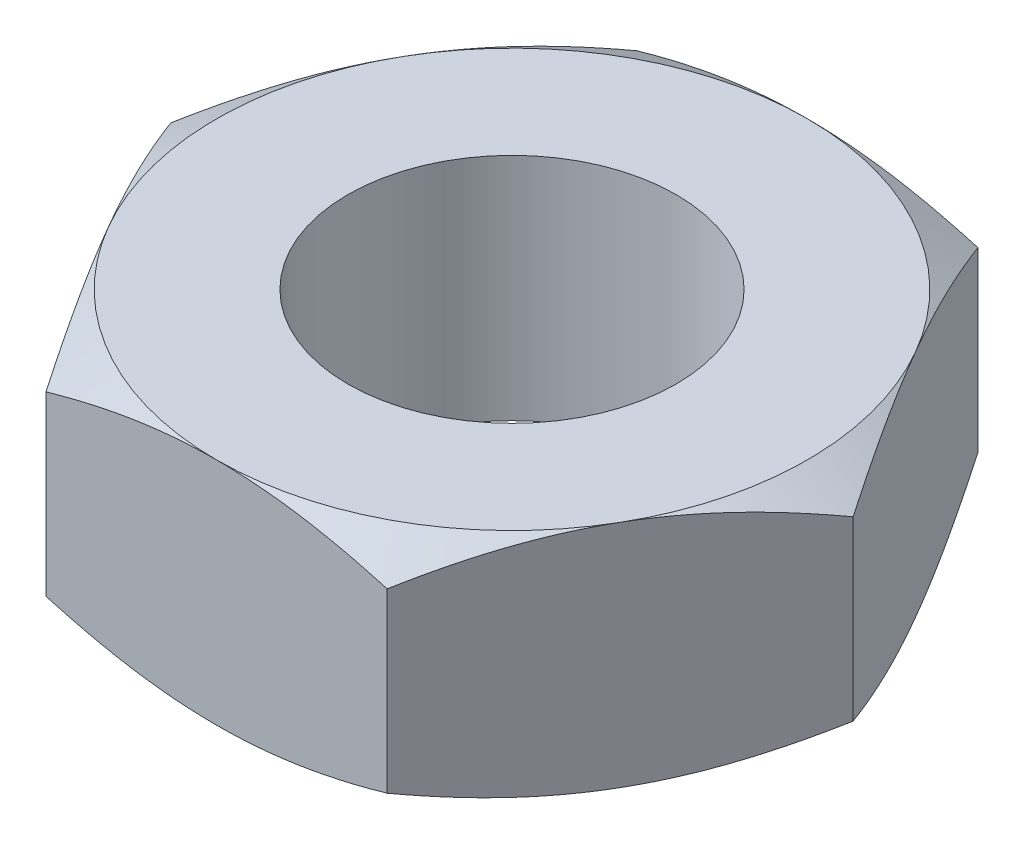
from build123d import *

# Parameters (mm, degrees)
SKETCH3_R               = 12.5
BOSS_EXTRUDE1_DEPTH     = 8.75
SKETCH4_OUTSIDE_W       = 75.076
SKETCH4_OUTSIDE_H       = 68.114
SKETCH4_OUTSIDE_R       = 22.5
CUT_EXTRUDE1_DEPTH      = 2
CUT_EXTRUDE1_DRAFT      = -60
MIRROR1_COPY_1_SKETCH_W = 75.076
MIRROR1_COPY_1_SKETCH_H = 68.114
MIRROR1_COPY_1_SKETCH_R = 22.5
MIRROR1_COPY_1_DEPTH    = 2
MIRROR1_COPY_1_DRAFT    = -60


with BuildPart() as part:
    # Sketch3 → Boss-Extrude1 (new, symmetric)
    with BuildSketch(Plane(origin=(0, 0, 0), x_dir=(1, 0, 0), z_dir=(0, 1, 0))):
        Polygon((25.980762114, 0), (12.990381057, 22.5), (-12.990381057, 22.5), (-25.980762114, 0), (-12.990381057, -22.5), (12.990381057, -22.5), align=None)
        with Locations(Location((0, 0, 0), (0, 0, 270))):
            Circle(SKETCH3_R, mode=Mode.SUBTRACT)
    extrude(amount=BOSS_EXTRUDE1_DEPTH, both=True)


with BuildPart() as cut_extrude1_tool:
    # Sketch4 outside → Cut-Extrude1 (with draft: the straight prism first)
    with BuildSketch(Plane.XZ.offset(8.75)):
        Rectangle(SKETCH4_OUTSIDE_W, SKETCH4_OUTSIDE_H)
        Circle(SKETCH4_OUTSIDE_R, mode=Mode.SUBTRACT)
    extrude(amount=-CUT_EXTRUDE1_DEPTH)
    # Cut-Extrude1: the draft: its side faces are tilted about the plane it starts from
    cut_extrude1_sides = [cut_extrude1_tool.faces().sort_by_distance(p)[0] for p in [
        (0, -7.75, -34.057),
        (37.538, -7.75, 0),
        (0, -7.75, 34.057),
        (-37.538, -7.75, 0),
        (-22.5, -7.75, 0),
    ]]
    draft(cut_extrude1_sides, Plane.XZ.offset(8.75), CUT_EXTRUDE1_DRAFT)


with BuildPart() as part_1:
    add(part.part)

    # Cut-Extrude1: cut by cut_extrude1_tool
    add(cut_extrude1_tool.part, mode=Mode.SUBTRACT)


with BuildPart() as mirror1_copy_1_tool:
    # Mirror1 copy 1 sketch → Mirror1 copy 1 (with draft: the straight prism first)
    with BuildSketch(Plane(origin=(0, 8.75, 0), x_dir=(1, 0, 0), z_dir=(0, 1, 0))):
        Rectangle(MIRROR1_COPY_1_SKETCH_W, MIRROR1_COPY_1_SKETCH_H)
        Circle(MIRROR1_COPY_1_SKETCH_R, mode=Mode.SUBTRACT)
    extrude(amount=-MIRROR1_COPY_1_DEPTH)
    # Mirror1 copy 1: the draft: its side faces are tilted about the plane it starts from
    mirror1_copy_1_sides = [mirror1_copy_1_tool.faces().sort_by_distance(p)[0] for p in [
        (0, 7.75, -34.057),
        (37.538, 7.75, 0),
        (0, 7.75, 34.057),
        (-37.538, 7.75, 0),
        (-22.5, 7.75, 0),
    ]]
    draft(mirror1_copy_1_sides, Plane(origin=(0, 8.75, 0), x_dir=(1, 0, 0), z_dir=(0, 1, 0)), MIRROR1_COPY_1_DRAFT)


with BuildPart() as part_2:
    add(part_1.part)

    # Mirror1 copy 1: cut by mirror1_copy_1_tool
    add(mirror1_copy_1_tool.part, mode=Mode.SUBTRACT)


solid = part_2.part
